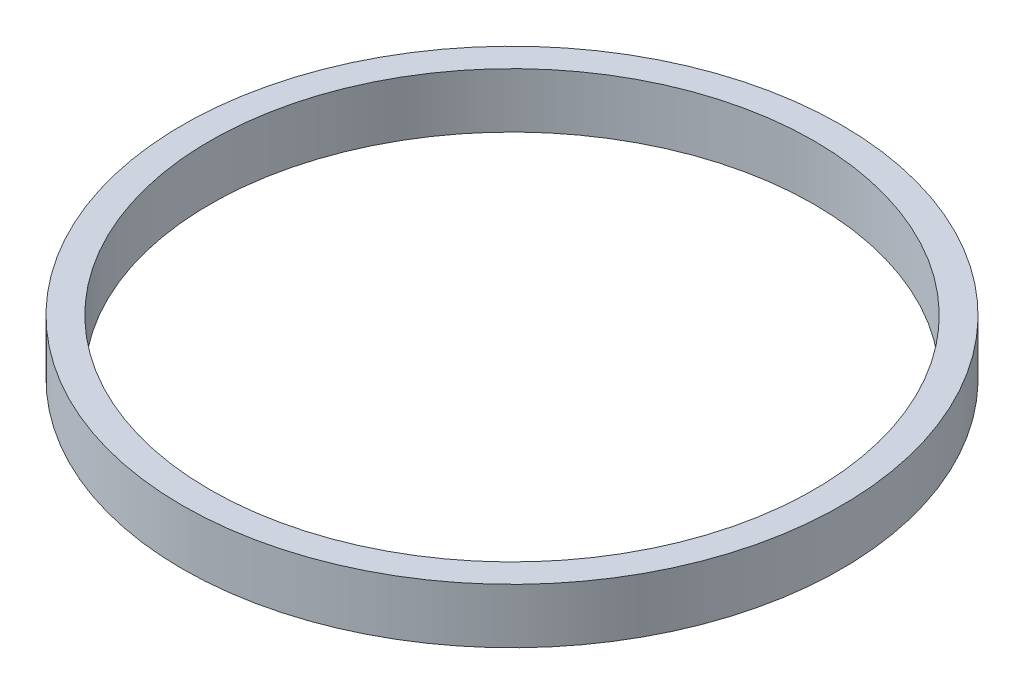
from build123d import *

# Parameters (mm, degrees)
SKETCH1_R           = 12
SKETCH1_R_2         = 11
BOSS_EXTRUDE1_DEPTH = 2


with BuildPart() as part:
    # Sketch1 → Boss-Extrude1 (new body)
    with BuildSketch(Plane(origin=(0, 0, 0), x_dir=(1, 0, 0), z_dir=(0, 1, 0))):
        with Locations(Location((0, 0, 0), (0, 0, 270))):
            Circle(SKETCH1_R)
        with Locations(Location((0, 0, 0), (0, 0, 270))):
            Circle(SKETCH1_R_2, mode=Mode.SUBTRACT)
    extrude(amount=BOSS_EXTRUDE1_DEPTH)


solid = part.part
